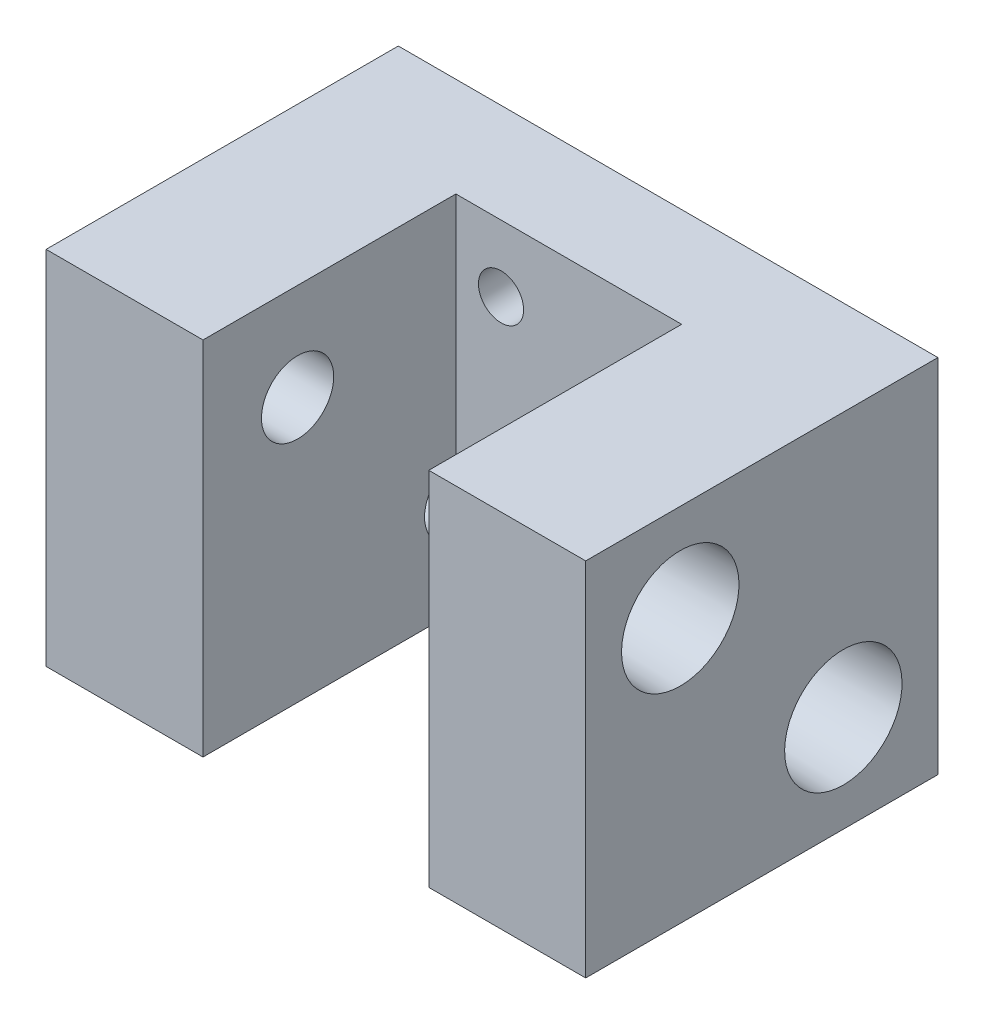
from build123d import *

# Parameters (mm, degrees)
SKETCH1_W                    = 15.6
SKETCH1_H                    = 16
BOSS_EXTRUDE1_DEPTH          = 6.95
SKETCH1_3_W                  = 4.4
SKETCH1_3_H                  = 16
BOSS_EXTRUDE2_DEPTH          = 16.95
BOSS_EXTRUDE3_START          = 16.95
SKETCH1_4_W                  = 15.6
SKETCH1_4_H                  = 16
BOSS_EXTRUDE3_DEPTH          = 6.95
SKETCH2_R                    = 2.6
CUT_EXTRUDE1_DEPTH           = 3.9
CUT_EXTRUDE1_DRAFT           = -1.5
CUT_EXTRUDE1_PROFILE_2_DEPTH = 3.9
CUT_EXTRUDE1_PROFILE_2_DRAFT = -1.5
SKETCH2_3_R                  = 1.6
CUT_EXTRUDE2_DEPTH           = 84.804594146
SKETCH3_R                    = 1
CUT_EXTRUDE3_DEPTH           = 79.499442673
SKETCH3_3_R                  = 2.1
CUT_EXTRUDE4_DEPTH           = 2
CUT_EXTRUDE5_START           = -23.9
SKETCH2_4_R                  = 2.6
CUT_EXTRUDE5_DEPTH           = 3.9
CUT_EXTRUDE5_DRAFT           = 1.5
CUT_EXTRUDE5_PROFILE_2_DEPTH = 3.9
CUT_EXTRUDE5_PROFILE_2_DRAFT = 1.5


with BuildPart() as part:
    # Sketch1 → Boss-Extrude1 (new body)
    with BuildSketch(Plane(origin=(-11.95, 0, 0), x_dir=(0, 0, -1), z_dir=(1, 0, 0))):
        with Locations((18.2, 68)):
            Rectangle(SKETCH1_W, SKETCH1_H)
    extrude(amount=BOSS_EXTRUDE1_DEPTH)

    # Sketch1<3> → Boss-Extrude2 (add)
    with BuildSketch(Plane(origin=(-11.95, 0, 0), x_dir=(0, 0, -1), z_dir=(1, 0, 0))):
        with Locations((23.8, 68)):
            Rectangle(SKETCH1_3_W, SKETCH1_3_H)
    extrude(amount=BOSS_EXTRUDE2_DEPTH)

    # Sketch1<4> → Boss-Extrude3 (add)
    with BuildSketch(Plane(origin=(-11.95, 0, 0), x_dir=(0, 0, -1), z_dir=(1, 0, 0)).offset(BOSS_EXTRUDE3_START)):
        with Locations((18.2, 68)):
            Rectangle(SKETCH1_4_W, SKETCH1_4_H)
    extrude(amount=BOSS_EXTRUDE3_DEPTH)


with BuildPart() as cut_extrude1_tool:
    # Sketch2 → Cut-Extrude1 (with draft: the straight prism first)
    with BuildSketch(Plane.ZY.offset(11.95)):
        with Locations((-21.811399183, 64.296000838)):
            Circle(SKETCH2_R)
    extrude(amount=-CUT_EXTRUDE1_DEPTH)
    # Cut-Extrude1: the draft: its side faces are tilted about the plane it starts from
    cut_extrude1_sides = [cut_extrude1_tool.faces().sort_by_distance(p)[0] for p in [
        (-10, 64.296000838, -24.411399183),
    ]]
    draft(cut_extrude1_sides, Plane.ZY.offset(11.95), CUT_EXTRUDE1_DRAFT)


with BuildPart() as part_1:
    add(part.part)

    # Cut-Extrude1: cut by cut_extrude1_tool
    add(cut_extrude1_tool.part, mode=Mode.SUBTRACT)


with BuildPart() as cut_extrude1_profile_2_tool:
    # Sketch2 → Cut-Extrude1 profile 2 (with draft: the straight prism first)
    with BuildSketch(Plane.ZY.offset(11.95)):
        with Locations((-14.588600817, 71.703999162)):
            Circle(SKETCH2_R)
    extrude(amount=-CUT_EXTRUDE1_PROFILE_2_DEPTH)
    # Cut-Extrude1 profile 2: the draft: its side faces are tilted about the plane it starts from
    cut_extrude1_profile_2_sides = [cut_extrude1_profile_2_tool.faces().sort_by_distance(p)[0] for p in [
        (-10, 71.703999162, -17.188600817),
    ]]
    draft(cut_extrude1_profile_2_sides, Plane.ZY.offset(11.95), CUT_EXTRUDE1_PROFILE_2_DRAFT)


with BuildPart() as part_2:
    add(part_1.part)

    # Cut-Extrude1 profile 2: cut by cut_extrude1_profile_2_tool
    add(cut_extrude1_profile_2_tool.part, mode=Mode.SUBTRACT)

    # Sketch2<3> → Cut-Extrude2 (cut, through all)
    with BuildSketch(Plane.ZY.offset(11.95)):
        with Locations(Location((-21.811399183, 64.296000838, 0), (0, 0, 270))):
            Circle(SKETCH2_3_R)
        with Locations(Location((-14.588600817, 71.703999162, 0), (0, 0, 270))):
            Circle(SKETCH2_3_R)
    extrude(amount=-CUT_EXTRUDE2_DEPTH, mode=Mode.SUBTRACT)

    # Sketch3 → Cut-Extrude3 (cut, through all)
    with BuildSketch(Plane(origin=(0, 0, -26), x_dir=(-1, 0, 0), z_dir=(0, 0, -1))):
        with Locations(Location((3, 73.05466329, 0), (0, 0, 90))):
            Circle(SKETCH3_R)
        with Locations(Location((-3, 63.05466329, 0), (0, 0, 90))):
            Circle(SKETCH3_R)
    extrude(amount=-CUT_EXTRUDE3_DEPTH, mode=Mode.SUBTRACT)

    # Sketch3<3> → Cut-Extrude4 (cut)
    with BuildSketch(Plane(origin=(0, 0, -26), x_dir=(-1, 0, 0), z_dir=(0, 0, -1))):
        with Locations(Location((3, 73.05466329, 0), (0, 0, 90))):
            Circle(SKETCH3_3_R)
        with Locations(Location((-3, 63.05466329, 0), (0, 0, 90))):
            Circle(SKETCH3_3_R)
    extrude(amount=-CUT_EXTRUDE4_DEPTH, mode=Mode.SUBTRACT)


with BuildPart() as cut_extrude5_tool:
    # Sketch2<4> → Cut-Extrude5 (with draft: the straight prism first)
    with BuildSketch(Plane.ZY.offset(11.95).offset(CUT_EXTRUDE5_START)):
        with Locations((-21.811399183, 64.296000838)):
            Circle(SKETCH2_4_R)
    extrude(amount=CUT_EXTRUDE5_DEPTH)
    # Cut-Extrude5: the draft: its side faces are tilted about the plane it starts from
    cut_extrude5_sides = [cut_extrude5_tool.faces().sort_by_distance(p)[0] for p in [
        (10, 64.296000838, -24.411399183),
    ]]
    draft(cut_extrude5_sides, Plane.ZY.offset(11.95).offset(CUT_EXTRUDE5_START), CUT_EXTRUDE5_DRAFT)


with BuildPart() as part_3:
    add(part_2.part)

    # Cut-Extrude5: cut by cut_extrude5_tool
    add(cut_extrude5_tool.part, mode=Mode.SUBTRACT)


with BuildPart() as cut_extrude5_profile_2_tool:
    # Sketch2<4> → Cut-Extrude5 profile 2 (with draft: the straight prism first)
    with BuildSketch(Plane.ZY.offset(11.95).offset(CUT_EXTRUDE5_START)):
        with Locations((-14.588600817, 71.703999162)):
            Circle(SKETCH2_4_R)
    extrude(amount=CUT_EXTRUDE5_PROFILE_2_DEPTH)
    # Cut-Extrude5 profile 2: the draft: its side faces are tilted about the plane it starts from
    cut_extrude5_profile_2_sides = [cut_extrude5_profile_2_tool.faces().sort_by_distance(p)[0] for p in [
        (10, 71.703999162, -17.188600817),
    ]]
    draft(cut_extrude5_profile_2_sides, Plane.ZY.offset(11.95).offset(CUT_EXTRUDE5_START), CUT_EXTRUDE5_PROFILE_2_DRAFT)


with BuildPart() as part_4:
    add(part_3.part)

    # Cut-Extrude5 profile 2: cut by cut_extrude5_profile_2_tool
    add(cut_extrude5_profile_2_tool.part, mode=Mode.SUBTRACT)


solid = part_4.part
